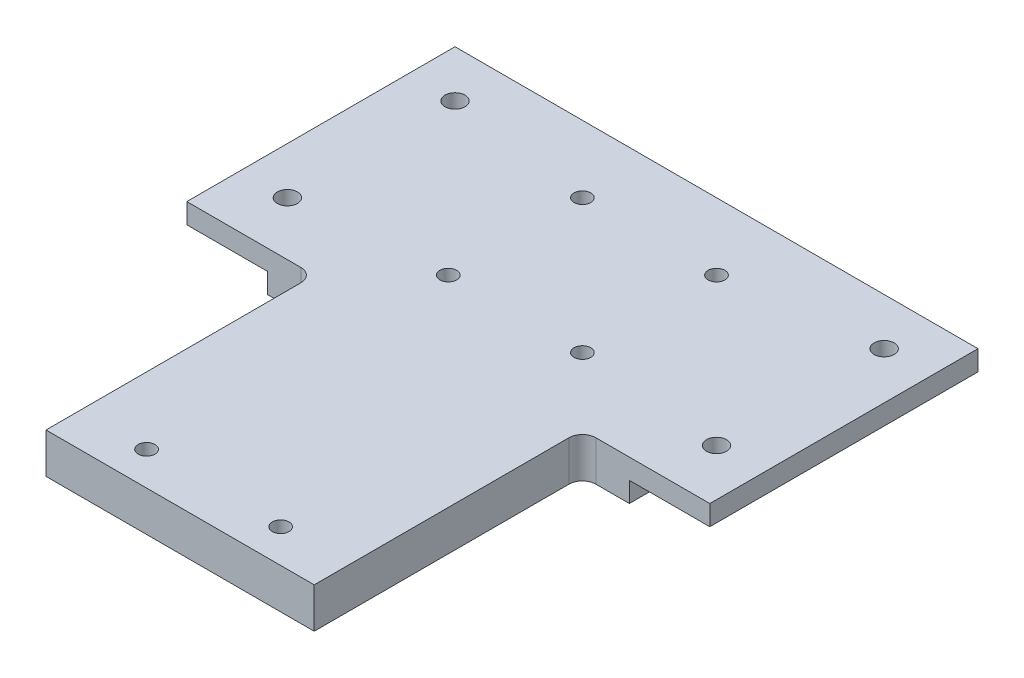
from build123d import *

# Parameters (mm, degrees)
EXTRUDE_1_DEPTH     = 6
FILLET_1_R          = 2
SKETCH_18_W         = 12
SKETCH_18_H         = 40
CUT_EXTRUDE_7_DEPTH = 3
SKETCH_19_R         = 1.5
CUT_EXTRUDE_8_DEPTH = 10
SKETCH_20_R         = 1.25
CUT_EXTRUDE_9_DEPTH = 10


with BuildPart() as part:
    # 草图1 → 凸台-拉伸1 (new body)
    with BuildSketch(Plane(origin=(0, 0, 0), x_dir=(1, 0, 0), z_dir=(0, 1, 0))):
        Polygon((0, 0), (40, 0), (40, 40), (59, 40), (59, 80), (-19, 80), (-19, 40), (0, 40), align=None)
    extrude(amount=EXTRUDE_1_DEPTH)

    # 圆角1
    fillet_1_edges = [part.edges().sort_by_distance(p)[0] for p in [
        (0, 3, -40),
        (40, 3, -40),
    ]]
    fillet(fillet_1_edges, radius=FILLET_1_R)

    # 草图18 → 切除-拉伸7 (cut)
    with BuildSketch(Plane.XZ):
        with Locations((-13, -60)):
            Rectangle(SKETCH_18_W, SKETCH_18_H)
        with Locations((53, -60)):
            Rectangle(SKETCH_18_W, SKETCH_18_H)
    extrude(amount=-CUT_EXTRUDE_7_DEPTH, mode=Mode.SUBTRACT)

    # 草图19 → 切除-拉伸8 (cut)
    with BuildSketch(Plane.XZ.offset(-3)):
        with Locations(Location((-12, -48, 0), (0, 0, 270))):
            Circle(SKETCH_19_R)
        with Locations(Location((-12, -73, 0), (0, 0, 270))):
            Circle(SKETCH_19_R)
        with Locations(Location((52, -73, 0), (0, 0, 90))):
            Circle(SKETCH_19_R)
        with Locations(Location((52, -48, 0), (0, 0, 90))):
            Circle(SKETCH_19_R)
    extrude(amount=-CUT_EXTRUDE_8_DEPTH, mode=Mode.SUBTRACT)

    # 草图20 → 切除-拉伸9 (cut)
    with BuildSketch(Plane.XZ):
        with Locations(Location((10, -5, 0), (0, 0, 270))):
            Circle(SKETCH_20_R)
        with Locations(Location((30, -5, 0), (0, 0, 270))):
            Circle(SKETCH_20_R)
        with Locations(Location((10, -50, 0), (0, 0, 270))):
            Circle(SKETCH_20_R)
        with Locations(Location((10, -70, 0), (0, 0, 270))):
            Circle(SKETCH_20_R)
        with Locations(Location((30, -50, 0), (0, 0, 270))):
            Circle(SKETCH_20_R)
        with Locations(Location((30, -70, 0), (0, 0, 270))):
            Circle(SKETCH_20_R)
    extrude(amount=-CUT_EXTRUDE_9_DEPTH, mode=Mode.SUBTRACT)


solid = part.part
